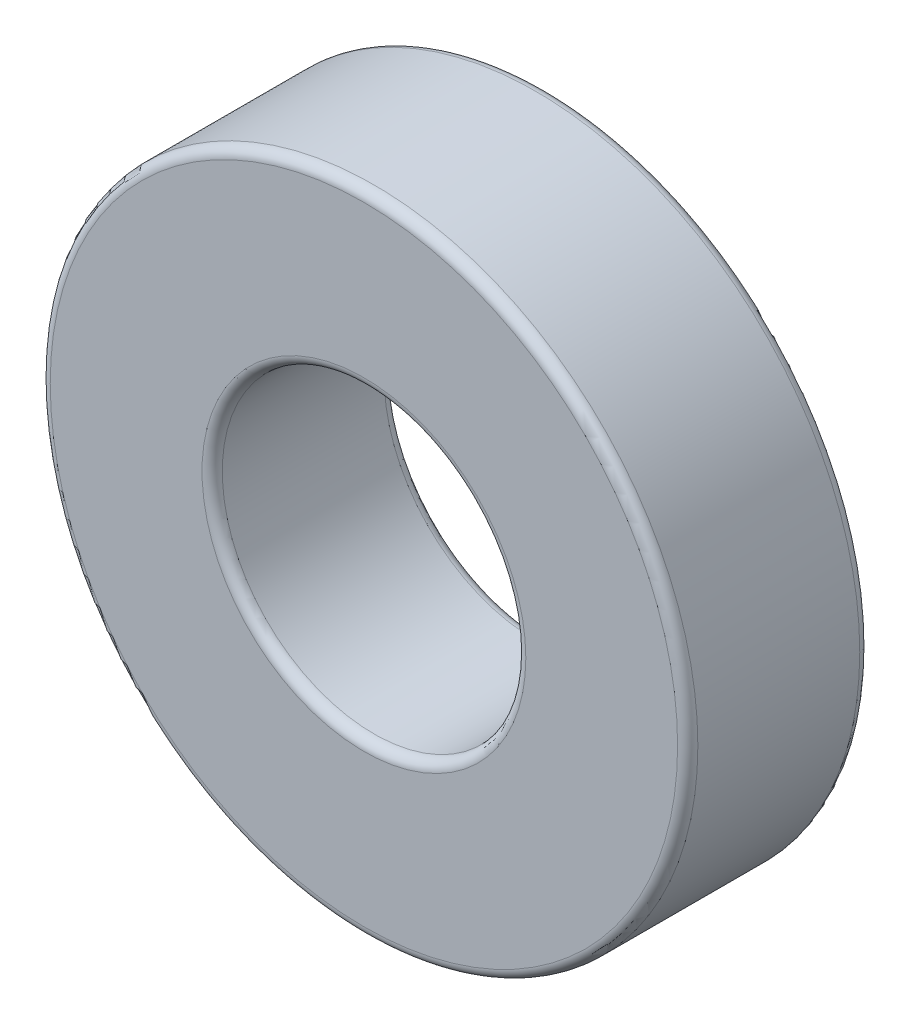
from build123d import *

# Parameters (mm, degrees)
SKETCH_1_R      = 16
SKETCH_1_R_2    = 7.5
EXTRUDE_1_DEPTH = 9
FILLET_1_R      = 0.5


with BuildPart() as part:
    # 草图1 → 拉伸1 (new body)
    with BuildSketch(Plane.XY):
        Circle(SKETCH_1_R)
        Circle(SKETCH_1_R_2, mode=Mode.SUBTRACT)
    extrude(amount=EXTRUDE_1_DEPTH)

    # 圆角1
    fillet_1_edges = [part.edges().sort_by_distance(p)[0] for p in [
        (-16, 0, 0),
        (-16, 0, 9),
        (-7.5, 0, 0),
        (-7.5, 0, 9),
    ]]
    fillet(fillet_1_edges, radius=FILLET_1_R)


solid = part.part
